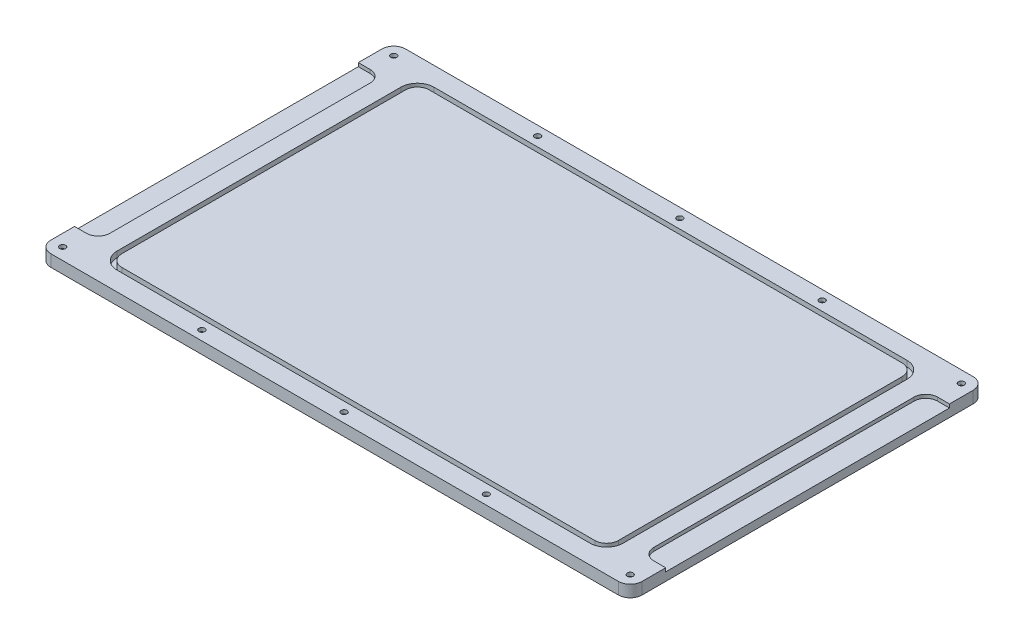
from build123d import *

# Parameters (mm, degrees)
EXTRUDE_1_DEPTH     = 5
CUT_EXTRUDE_1_DEPTH = 1.5
CUT_EXTRUDE_2_DEPTH = 2.5
SKETCH_4_R          = 1.25
CUT_EXTRUDE_3_DEPTH = 5
SKETCH_5_R          = 2.85
CUT_EXTRUDE_4_DEPTH = 3.5
SKETCH_6_R          = 1.25
CUT_EXTRUDE_5_DEPTH = 5
SKETCH_7_R          = 2.85
CUT_EXTRUDE_6_DEPTH = 3.5


with BuildPart() as part:
    # 草图1 → 凸台-拉伸1 (new body)
    with BuildSketch(Plane(origin=(0, 0, 0), x_dir=(1, 0, 0), z_dir=(0, 1, 0))):
        with BuildLine():
            Line((-120, 75), (120, 75))
            ThreePointArc((120, 75), (123.535533906, 73.535533906), (125, 70))
            Line((125, 70), (125, -70))
            ThreePointArc((125, -70), (123.535533906, -73.535533906), (120, -75))
            Line((120, -75), (-120, -75))
            ThreePointArc((-120, -75), (-123.535533906, -73.535533906), (-125, -70))
            Line((-125, -70), (-125, 70))
            ThreePointArc((-125, 70), (-123.535533906, 73.535533906), (-120, 75))
        make_face()
    extrude(amount=EXTRUDE_1_DEPTH)

    # 草图2 → 切除-拉伸1 (cut)
    with BuildSketch(Plane(origin=(0, 5, 0), x_dir=(1, 0, 0), z_dir=(0, 1, 0))):
        with BuildLine():
            Line((-125, 60), (-120, 60))
            ThreePointArc((-120, 60), (-116.464466094, 58.535533906), (-115, 55))
            Line((-115, 55), (-115, -55))
            ThreePointArc((-115, -55), (-116.464466094, -58.535533906), (-120, -60))
            Line((-120, -60), (-125, -60))
            Line((-125, -60), (-125, 60))
        make_face()
        with BuildLine():
            Line((115, 55), (115, -55))
            ThreePointArc((115, -55), (116.464466094, -58.535533906), (120, -60))
            Line((120, -60), (125, -60))
            Line((125, -60), (125, 60))
            Line((125, 60), (120, 60))
            ThreePointArc((120, 60), (116.464466094, 58.535533906), (115, 55))
        make_face()
    extrude(amount=-CUT_EXTRUDE_1_DEPTH, mode=Mode.SUBTRACT)

    # 草图3 → 切除-拉伸2 (cut)
    with BuildSketch(Plane(origin=(0, 5, 0), x_dir=(1, 0, 0), z_dir=(0, 1, 0))):
        with BuildLine():
            Line((-100, 67), (100, 67))
            ThreePointArc((100, 67), (104.949747468, 64.949747468), (107, 60))
            Line((107, 60), (107, -60))
            ThreePointArc((107, -60), (104.949747468, -64.949747468), (100, -67))
            Line((100, -67), (-100, -67))
            ThreePointArc((-100, -67), (-104.949747468, -64.949747468), (-107, -60))
            Line((-107, -60), (-107, 60))
            ThreePointArc((-107, 60), (-104.949747468, 64.949747468), (-100, 67))
        make_face()
        with BuildLine():
            Line((-100, 65), (100, 65))
            ThreePointArc((100, 65), (103.535533906, 63.535533906), (105, 60))
            Line((105, 60), (105, -60))
            ThreePointArc((105, -60), (103.535533906, -63.535533906), (100, -65))
            Line((100, -65), (-100, -65))
            ThreePointArc((-100, -65), (-103.535533906, -63.535533906), (-105, -60))
            Line((-105, -60), (-105, 60))
            ThreePointArc((-105, 60), (-103.535533906, 63.535533906), (-100, 65))
        make_face(mode=Mode.SUBTRACT)
    extrude(amount=-CUT_EXTRUDE_2_DEPTH, mode=Mode.SUBTRACT)

    # 草图4 → 切除-拉伸3 (cut)
    with BuildSketch(Plane.XZ):
        with Locations(Location((-120, 70, 0), (0, 0, 270))):
            Circle(SKETCH_4_R)
        with Locations(Location((-120, -70, 0), (0, 0, 270))):
            Circle(SKETCH_4_R)
        with Locations(Location((120, -70, 0), (0, 0, 270))):
            Circle(SKETCH_4_R)
        with Locations(Location((120, 70, 0), (0, 0, 270))):
            Circle(SKETCH_4_R)
    extrude(amount=-CUT_EXTRUDE_3_DEPTH, mode=Mode.SUBTRACT)

    # 草图5 → 切除-拉伸4 (cut)
    with BuildSketch(Plane.XZ):
        with Locations(Location((-120, 70, 0), (0, 0, 270))):
            Circle(SKETCH_5_R)
        with Locations(Location((-120, -70, 0), (0, 0, 270))):
            Circle(SKETCH_5_R)
        with Locations(Location((120, -70, 0), (0, 0, 270))):
            Circle(SKETCH_5_R)
        with Locations(Location((120, 70, 0), (0, 0, 270))):
            Circle(SKETCH_5_R)
    extrude(amount=-CUT_EXTRUDE_4_DEPTH, mode=Mode.SUBTRACT)

    # 草图6 → 切除-拉伸5 (cut)
    with BuildSketch(Plane(origin=(0, 5, 0), x_dir=(1, 0, 0), z_dir=(0, 1, 0))):
        with Locations(Location((0, 71, 0), (0, 0, 270))):
            Circle(SKETCH_6_R)
        with Locations(Location((-60.164669271, 71, 0), (0, 0, 270))):
            Circle(SKETCH_6_R)
        with Locations(Location((60.164669271, 71, 0), (0, 0, 90))):
            Circle(SKETCH_6_R)
        with Locations(Location((60.164669271, -71, 0), (0, 0, 270))):
            Circle(SKETCH_6_R)
        with Locations(Location((-60.164669271, -71, 0), (0, 0, 90))):
            Circle(SKETCH_6_R)
        with Locations(Location((0, -71, 0), (0, 0, 90))):
            Circle(SKETCH_6_R)
    extrude(amount=-CUT_EXTRUDE_5_DEPTH, mode=Mode.SUBTRACT)

    # 草图7 → 切除-拉伸6 (cut)
    with BuildSketch(Plane.XZ):
        with Locations(Location((-60.164669271, 71, 0), (0, 0, 270))):
            Circle(SKETCH_7_R)
        with Locations(Location((0, 71, 0), (0, 0, 270))):
            Circle(SKETCH_7_R)
        with Locations(Location((60.164669271, 71, 0), (0, 0, 270))):
            Circle(SKETCH_7_R)
        with Locations(Location((60.164669271, -71, 0), (0, 0, 90))):
            Circle(SKETCH_7_R)
        with Locations(Location((0, -71, 0), (0, 0, 90))):
            Circle(SKETCH_7_R)
        with Locations(Location((-60.164669271, -71, 0), (0, 0, 90))):
            Circle(SKETCH_7_R)
    extrude(amount=-CUT_EXTRUDE_6_DEPTH, mode=Mode.SUBTRACT)


solid = part.part
